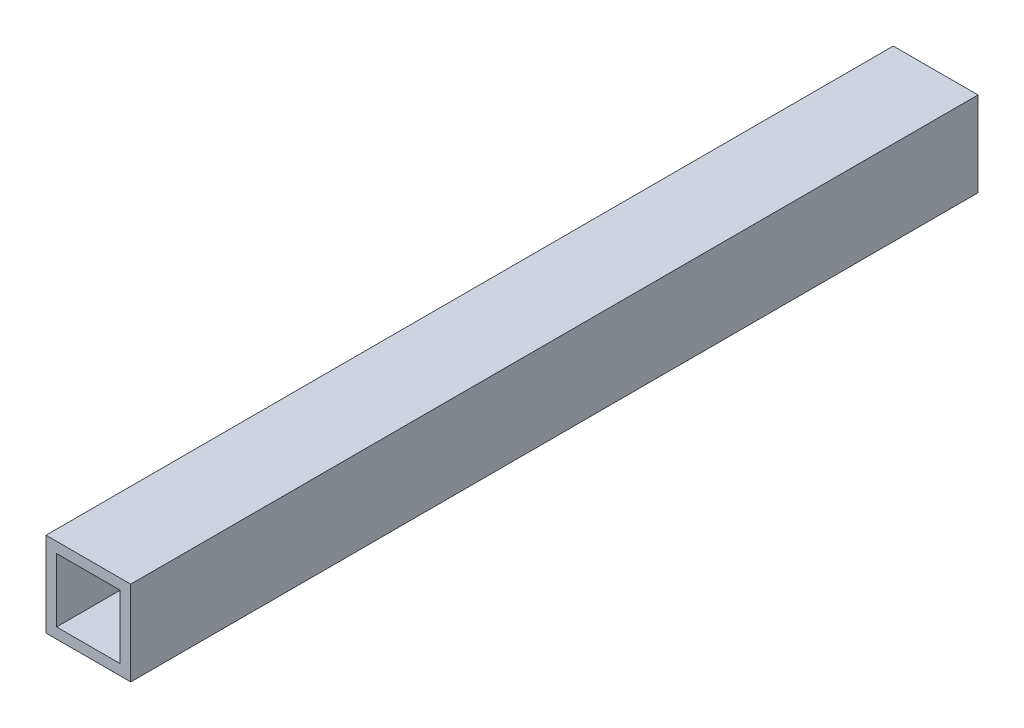
from build123d import *

# Parameters (mm, degrees)
SKETCH1_W           = 25.4
SKETCH1_H           = 25.4
SKETCH1_W_2         = 19.05
SKETCH1_H_2         = 19.05
BOSS_EXTRUDE1_DEPTH = 254


with BuildPart() as part:
    # Sketch1 → Boss-Extrude1 (new body)
    with BuildSketch(Plane.XY):
        with Locations((-12.7, 12.7)):
            Rectangle(SKETCH1_W, SKETCH1_H)
        with Locations((-12.7, 12.7)):
            Rectangle(SKETCH1_W_2, SKETCH1_H_2, mode=Mode.SUBTRACT)
    extrude(amount=BOSS_EXTRUDE1_DEPTH)


solid = part.part
